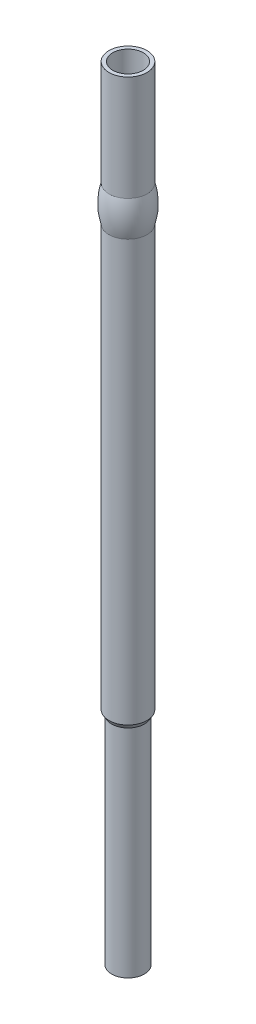
from build123d import *


with BuildPart() as part:
    # Sketch1 → Revolve1 (revolve)
    with BuildSketch(Plane(origin=(0, 0, 0), x_dir=(0, 0, -1), z_dir=(1, 0, 0)), mode=Mode.PRIVATE) as revolve1_sk:
        with BuildLine():
            Line((0.345, 0), (0.345, -12.56))
            Line((0.345, -12.56), (0, -12.56))
            Line((0, -12.56), (0, -12.8))
            Line((0, -12.8), (0.28, -12.8))
            Line((0.28, -12.8), (0.28, -17.7))
            Line((0.28, -17.7), (0.37, -17.7))
            Line((0.37, -17.7), (0.37, -12.8))
            Line((0.37, -12.8), (0.43, -12.7))
            Line((0.43, -12.7), (0.43, -3.18))
            ThreePointArc((0.43, -3.18), (0.485, -2.78), (0.43, -2.38))
            Line((0.43, -2.38), (0.43, 0))
            Line((0.43, 0), (0.345, 0))
        make_face()
    revolve(revolve1_sk.sketch.rotate(Axis((0, -12.56, 0), (0, -1, 0)), 180), axis=Axis((0, -12.56, 0), (0, -1, 0)))


solid = part.part
